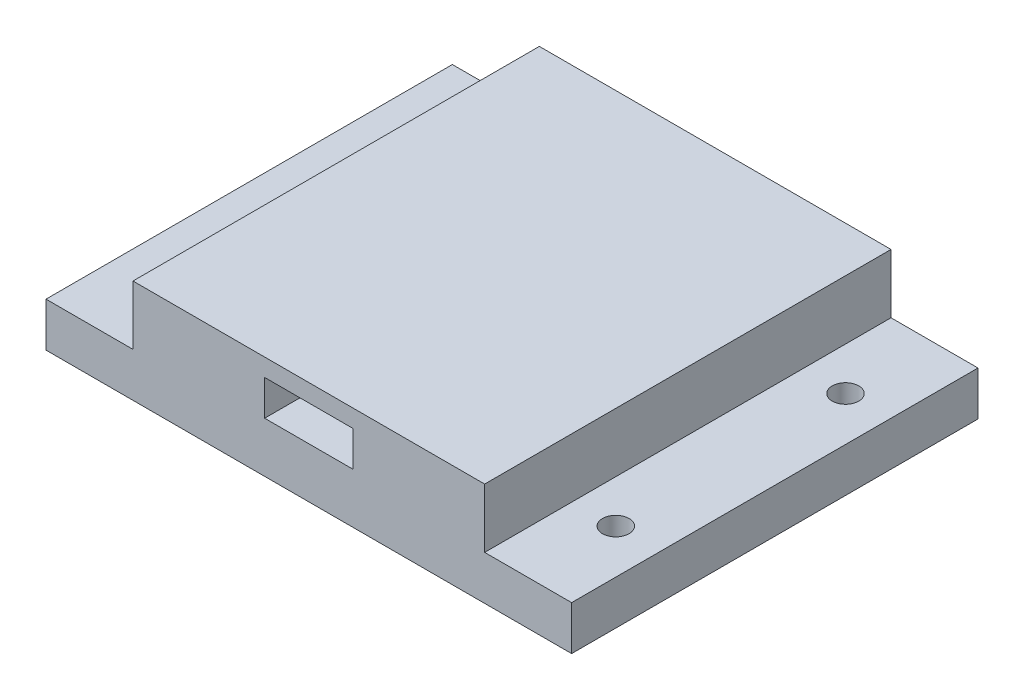
from build123d import *

# Parameters (mm, degrees)
SKETCH_1_W          = 59.5
SKETCH_1_H          = 46
SKETCH_1_R          = 1.5
EXTRUDE_1_DEPTH     = 5
SKETCH_2_W          = 39.81
SKETCH_2_H          = 46
EXTRUDE_2_DEPTH     = 6.7
SKETCH_3_W          = 10
SKETCH_3_H          = 4
CUT_EXTRUDE_1_DEPTH = 6.7


with BuildPart() as part:
    # 草图1 → 凸台-拉伸1 (new body)
    with BuildSketch(Plane(origin=(0, 0, 0), x_dir=(1, 0, 0), z_dir=(0, 1, 0))):
        Rectangle(SKETCH_1_W, SKETCH_1_H)
        with Locations(Location((24.75, 13, 0), (0, 0, 270))):
            Circle(SKETCH_1_R, mode=Mode.SUBTRACT)
        with Locations(Location((24.75, -13, 0), (0, 0, 90))):
            Circle(SKETCH_1_R, mode=Mode.SUBTRACT)
        with Locations(Location((-24.75, -13, 0), (0, 0, 270))):
            Circle(SKETCH_1_R, mode=Mode.SUBTRACT)
        with Locations(Location((-24.75, 13, 0), (0, 0, 90))):
            Circle(SKETCH_1_R, mode=Mode.SUBTRACT)
    extrude(amount=EXTRUDE_1_DEPTH)

    # 草图2 → 凸台-拉伸2 (add)
    with BuildSketch(Plane(origin=(0, 5, 0), x_dir=(1, 0, 0), z_dir=(0, 1, 0))):
        Rectangle(SKETCH_2_W, SKETCH_2_H)
    extrude(amount=EXTRUDE_2_DEPTH)

    # 草图3 → 切除-拉伸1 (cut)
    with BuildSketch(Plane.XY.offset(23)):
        with Locations((0, 7.7)):
            Rectangle(SKETCH_3_W, SKETCH_3_H)
    extrude(amount=-CUT_EXTRUDE_1_DEPTH, mode=Mode.SUBTRACT)


solid = part.part
